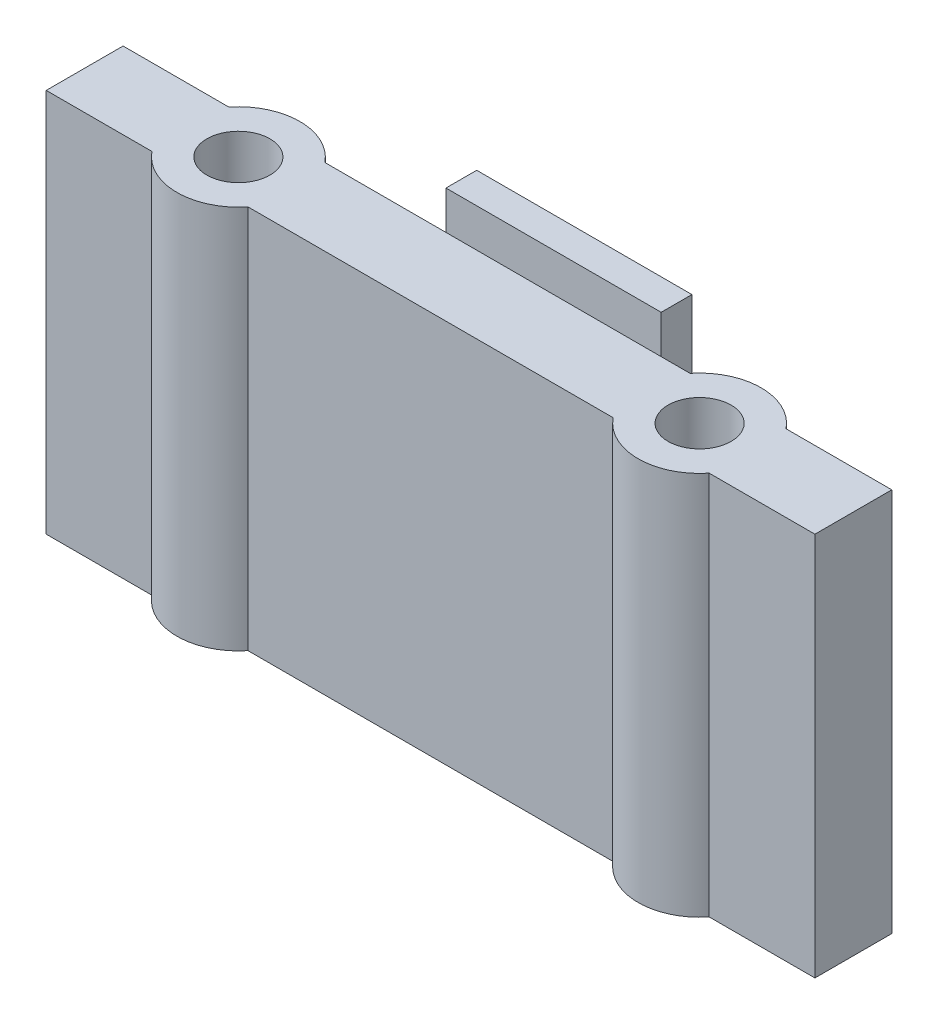
from build123d import *

# Parameters (mm, degrees)
SKETCH1_R           = 2.05
BOSS_EXTRUDE1_DEPTH = 25
SKETCH2_W           = 14
SKETCH2_H           = 2
BOSS_EXTRUDE2_DEPTH = 5
SKETCH3_W           = 14
SKETCH3_H           = 2
BOSS_EXTRUDE3_DEPTH = 4
RIB3_REACH          = 43.295
SKETCH4_WALL_W      = 91.660413372
SKETCH4_WALL_H      = 14


with BuildPart() as part:
    # Sketch1 → Boss-Extrude1 (new body)
    with BuildSketch(Plane(origin=(0, 0, 0), x_dir=(1, 0, 0), z_dir=(0, 1, 0))):
        with BuildLine():
            Line((-25, 2.5), (-18.122498999, 2.5))
            ThreePointArc((-18.122498999, 2.5), (-15, 4), (-11.877501001, 2.5))
            Line((-11.877501001, 2.5), (11.877501001, 2.5))
            ThreePointArc((11.877501001, 2.5), (15, 4), (18.122498999, 2.5))
            Line((18.122498999, 2.5), (25, 2.5))
            Line((25, 2.5), (25, -2.5))
            Line((25, -2.5), (18.122498999, -2.5))
            ThreePointArc((18.122498999, -2.5), (15, -4), (11.877501001, -2.5))
            Line((11.877501001, -2.5), (-11.877501001, -2.5))
            ThreePointArc((-11.877501001, -2.5), (-15, -4), (-18.122498999, -2.5))
            Line((-18.122498999, -2.5), (-25, -2.5))
            Line((-25, -2.5), (-25, 2.5))
        make_face()
        with Locations(Location((-15, 0, 0), (0, 0, 270))):
            Circle(SKETCH1_R, mode=Mode.SUBTRACT)
        with Locations(Location((15, 0, 0), (0, 0, 270))):
            Circle(SKETCH1_R, mode=Mode.SUBTRACT)
    extrude(amount=BOSS_EXTRUDE1_DEPTH)

    # Sketch2 → Boss-Extrude2 (add)
    with BuildSketch(Plane(origin=(0, 0, -2.5), x_dir=(-1, 0, 0), z_dir=(0, 0, -1))):
        with Locations((0, 19.5)):
            Rectangle(SKETCH2_W, SKETCH2_H)
    extrude(amount=BOSS_EXTRUDE2_DEPTH)

    # Sketch3 → Boss-Extrude3 (add)
    with BuildSketch(Plane(origin=(0, 20.5, 0), x_dir=(1, 0, 0), z_dir=(0, 1, 0))):
        with Locations((0, 6.5)):
            Rectangle(SKETCH3_W, SKETCH3_H)
    extrude(amount=BOSS_EXTRUDE3_DEPTH)

    # Sketch4 wall → Rib3 (add, up to next)
    with BuildSketch(Plane(origin=(-7, 16, -5), x_dir=(0, -0.707106781187, 0.707106781187), z_dir=(0, 0.707106781187, 0.707106781187)), mode=Mode.PRIVATE) as rib3_sk1:
        with Locations((0, 7)):
            Rectangle(SKETCH4_WALL_W, SKETCH4_WALL_H)
    rib3_tool1 = extrude(rib3_sk1.sketch, amount=RIB3_REACH, mode=Mode.PRIVATE) - part.part
    add(rib3_tool1.solids().sort_by_distance((-7, 16, -5))[0])


solid = part.part
